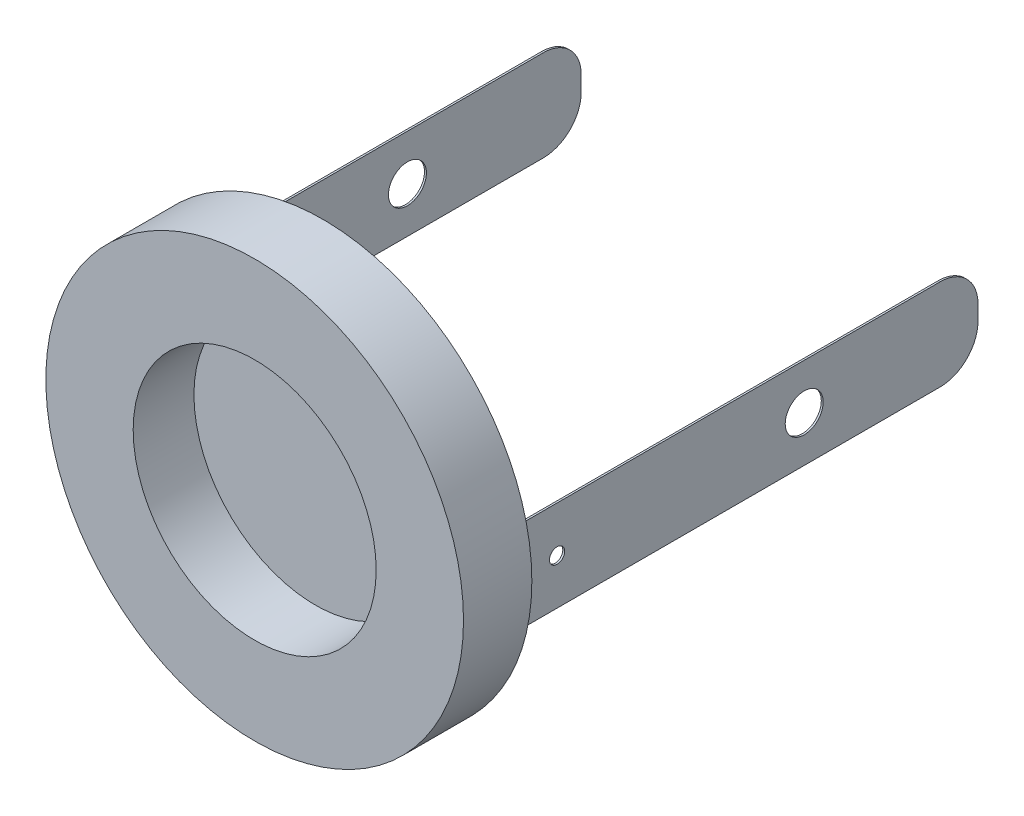
from build123d import *

# Parameters (mm, degrees)
SKETCH1_R               = 27.5
BOSS_EXTRUDE1_DEPTH     = 1
SKETCH2_R               = 27.5
SKETCH2_R_2             = 16
BOSS_EXTRUDE2_DEPTH     = 8
SKETCH3_W               = 0.250349807
SKETCH3_H               = 12
BOSS_EXTRUDE3_DEPTH     = 60
CUT_EXTRUDE1_DEPTH      = 72.50174823
CUT_EXTRUDE1_DEPTH_BACK = 72.50174823
SKETCH4_R               = 2.5
SKETCH4_R_2             = 1
FILLET1_R               = 5


with BuildPart() as part:
    # Sketch1 → Boss-Extrude1 (new body)
    with BuildSketch(Plane.XY):
        Circle(SKETCH1_R)
    extrude(amount=BOSS_EXTRUDE1_DEPTH)

    # Sketch2 → Boss-Extrude2 (add)
    with BuildSketch(Plane.XY.offset(1)):
        Circle(SKETCH2_R)
        Circle(SKETCH2_R_2, mode=Mode.SUBTRACT)
    extrude(amount=BOSS_EXTRUDE2_DEPTH)

    # Sketch3 → Boss-Extrude3 (add)
    with BuildSketch(Plane(origin=(0, 0, 0), x_dir=(-1, 0, 0), z_dir=(0, 0, -1))):
        with Locations((-26.125174904, 0)):
            Rectangle(SKETCH3_W, SKETCH3_H)
        with Locations((26.125174904, 0)):
            Rectangle(SKETCH3_W, SKETCH3_H)
    extrude(amount=BOSS_EXTRUDE3_DEPTH)

    # Sketch4 → Cut-Extrude1 (cut, two sides: drawn at the far end of the back side and taken through both)
    with BuildSketch(Plane(origin=(0, 0, 0), x_dir=(0, 0, -1), z_dir=(1, 0, 0)).offset(-CUT_EXTRUDE1_DEPTH_BACK)):
        with Locations((37.113852525, 0)):
            Circle(SKETCH4_R)
        with Locations((4.573176496, 0)):
            Circle(SKETCH4_R_2)
    extrude(amount=CUT_EXTRUDE1_DEPTH + CUT_EXTRUDE1_DEPTH_BACK, mode=Mode.SUBTRACT)

    # Fillet1
    fillet1_edges = [part.edges().sort_by_distance(p)[0] for p in [
        (-26.125174903, -6, -60),
        (-26.125174903, 6, -60),
        (26.125174903, -6, -60),
        (26.125174903, 6, -60),
    ]]
    fillet(fillet1_edges, radius=FILLET1_R)


solid = part.part
